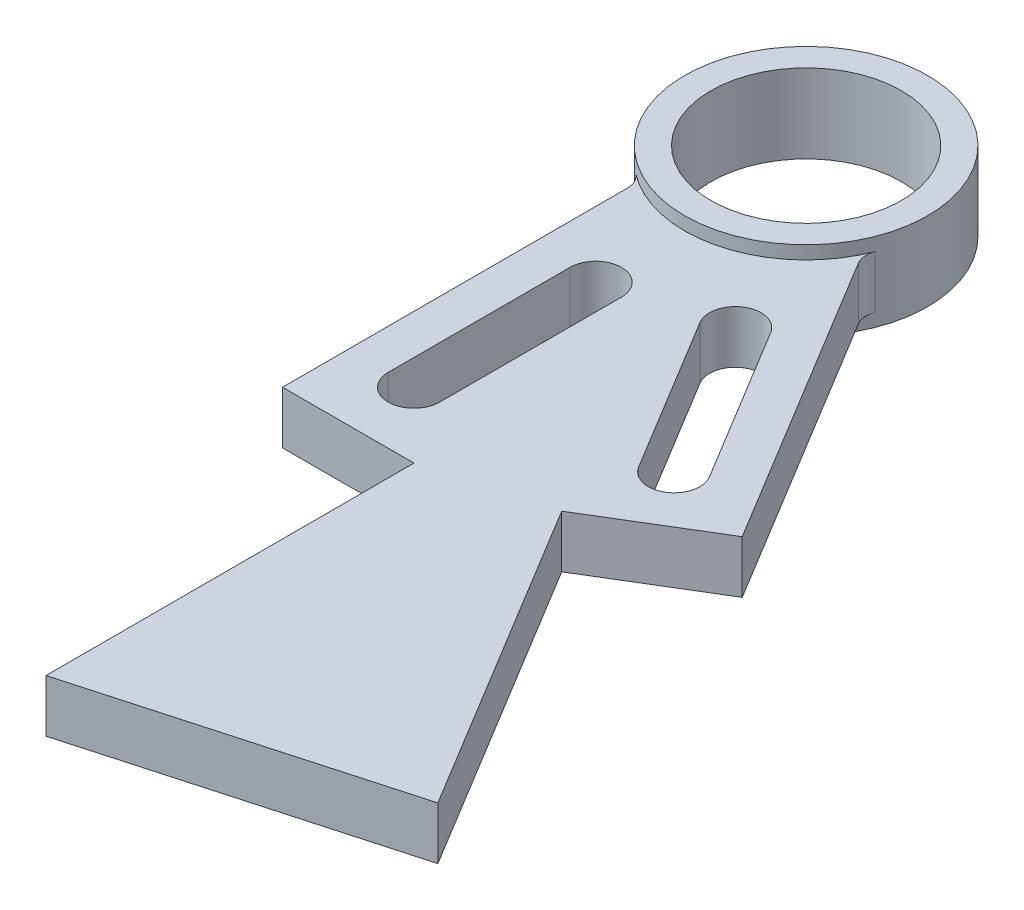
from build123d import *

# Parameters (mm, degrees)
SKETCH1_R             = 14.6812
SKETCH1_R_2           = 11.5062
BEARING_EXTRUDE_DEPTH = 4.7625
BOSS_EXTRUDE2_DEPTH   = 3.175
FILLET1_R             = 2.54


with BuildPart() as part:
    # Sketch1 → Bearing extrude (new, symmetric)
    with BuildSketch(Plane(origin=(0, 0, 0), x_dir=(1, 0, 0), z_dir=(0, 1, 0))):
        with Locations(Location((0, 0, 0), (0, 0, 90))):
            Circle(SKETCH1_R)
        with Locations(Location((0, 0, 0), (0, 0, 90))):
            Circle(SKETCH1_R_2, mode=Mode.SUBTRACT)
    extrude(amount=BEARING_EXTRUDE_DEPTH, both=True)

    # Sketch1<5> → Boss-Extrude2 (add, symmetric)
    with BuildSketch(Plane(origin=(0, 0, 0), x_dir=(1, 0, 0), z_dir=(0, 1, 0))):
        with BuildLine():
            Line((-7.9375, -12.350454534), (-7.9375, -55.3212))
            Line((-7.9375, -55.3212), (7.9375, -55.3212))
            Line((7.9375, -55.3212), (7.9375, -99.7712))
            Line((7.9375, -99.7712), (44.936648924, -89.431503617))
            Line((44.936648924, -89.431503617), (21.89252839, -51.421360118))
            Line((21.89252839, -51.421360118), (28.680054014, -47.306338594))
            Line((28.680054014, -47.306338594), (35.467579639, -43.19131707))
            Line((35.467579639, -43.19131707), (13.190345938, -6.446115688))
            ThreePointArc((13.190345938, -6.446115688), (3.951379748, -14.13945655), (-7.9375, -12.350454534))
        make_face()
        with BuildLine():
            ThreePointArc((3.1115, -47.3837), (0, -50.4952), (-3.1115, -47.3837))
            Line((-3.1115, -47.3837), (-3.1115, -25.4127))
            ThreePointArc((-3.1115, -25.4127), (0, -22.3012), (3.1115, -25.4127))
            Line((3.1115, -25.4127), (3.1115, -47.3837))
        make_face(mode=Mode.SUBTRACT)
        with BuildLine():
            ThreePointArc((27.225742535, -38.905724532), (27.587064378, -41.259593312), (26.178120928, -43.179523014))
            ThreePointArc((26.178120928, -43.179523014), (23.824252147, -43.540844858), (21.904322445, -42.131901407))
            Line((21.904322445, -42.131901407), (10.513942867, -23.344030478))
            ThreePointArc((10.513942867, -23.344030478), (11.561564474, -19.070231995), (15.835362956, -20.117853603))
            Line((15.835362956, -20.117853603), (27.225742535, -38.905724532))
        make_face(mode=Mode.SUBTRACT)
    extrude(amount=BOSS_EXTRUDE2_DEPTH, both=True)

    # Fillet1
    fillet1_edges = [part.edges().sort_by_distance(p)[0] for p in [
        (13.190345938, 0, 6.446115688),
        (-7.9375, 0, 12.350454534),
    ]]
    fillet(fillet1_edges, radius=FILLET1_R)


solid = part.part
